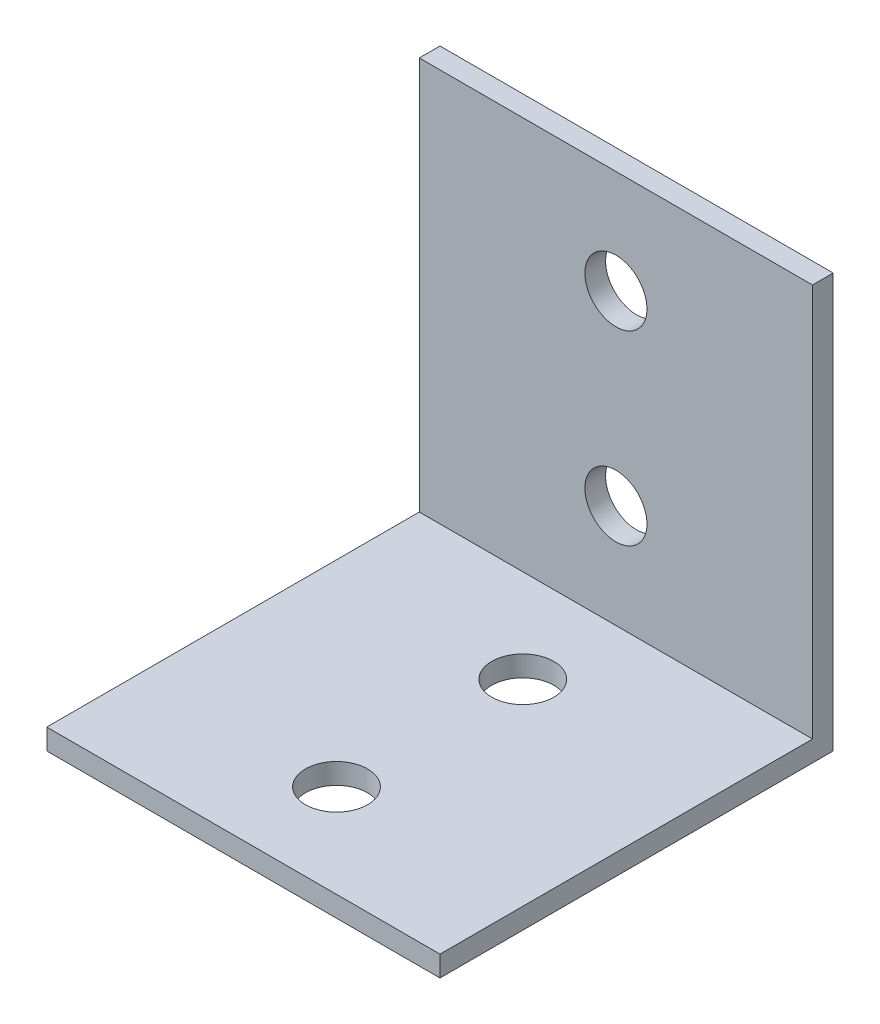
from build123d import *

# Parameters (mm, degrees)
SKETCH1_W           = 38
SKETCH1_H           = 38
BOSS_EXTRUDE1_DEPTH = 2
SKETCH2_W           = 38
SKETCH2_H           = 2
BOSS_EXTRUDE2_DEPTH = 38
SKETCH3_R           = 3
CUT_EXTRUDE1_DEPTH  = 10
SKETCH4_R           = 3
CUT_EXTRUDE2_DEPTH  = 10


with BuildPart() as part:
    # Sketch1 → Boss-Extrude1 (new body)
    with BuildSketch(Plane(origin=(0, 0, 0), x_dir=(1, 0, 0), z_dir=(0, 1, 0))):
        with Locations((-13.081650622, 15.738235294)):
            Rectangle(SKETCH1_W, SKETCH1_H)
    extrude(amount=BOSS_EXTRUDE1_DEPTH)

    # Sketch2 → Boss-Extrude2 (add)
    with BuildSketch(Plane(origin=(0, 2, 0), x_dir=(1, 0, 0), z_dir=(0, 1, 0))):
        with Locations((-13.081650622, 33.738235294)):
            Rectangle(SKETCH2_W, SKETCH2_H)
    extrude(amount=BOSS_EXTRUDE2_DEPTH)

    # Sketch3 → Cut-Extrude1 (cut)
    with BuildSketch(Plane.XY.offset(-32.738235294)):
        with Locations((-13.081650622, 30)):
            Circle(SKETCH3_R)
        with Locations((-13.081650622, 12)):
            Circle(SKETCH3_R)
    extrude(amount=-CUT_EXTRUDE1_DEPTH, mode=Mode.SUBTRACT)

    # Sketch4 → Cut-Extrude2 (cut)
    with BuildSketch(Plane(origin=(0, 2, 0), x_dir=(1, 0, 0), z_dir=(0, 1, 0))):
        with Locations(Location((-13.081650622, 5.738235294, 0), (0, 0, 270))):
            Circle(SKETCH4_R)
        with Locations(Location((-13.081650622, 23.738235294, 0), (0, 0, 270))):
            Circle(SKETCH4_R)
    extrude(amount=-CUT_EXTRUDE2_DEPTH, mode=Mode.SUBTRACT)


solid = part.part
